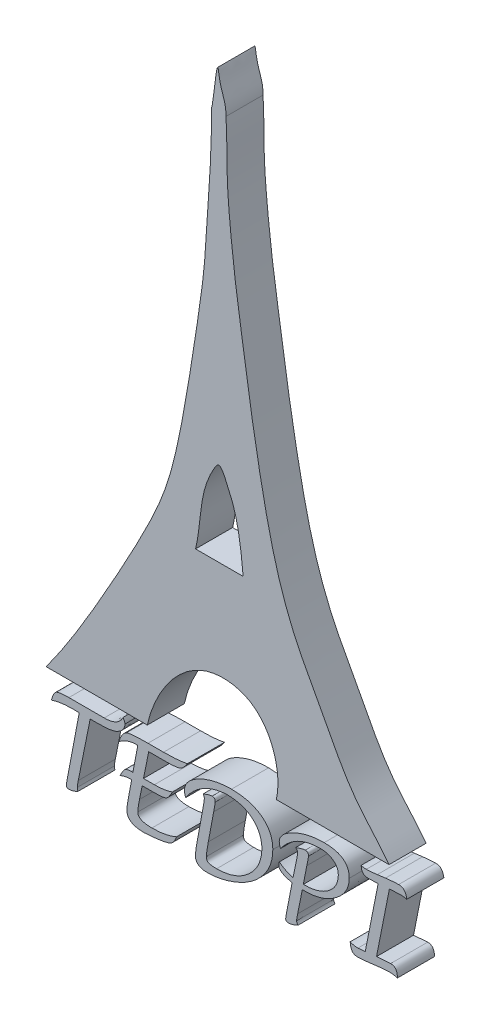
from build123d import *

# Parameters (mm, degrees)
BOSS_EXTRU_1_DEPTH   = 1
BOSS_EXTRU_1_2_DEPTH = 1
BOSS_EXTRU_1_3_DEPTH = 1
BOSS_EXTRU_1_4_DEPTH = 1
BOSS_EXTRU_1_5_DEPTH = 1
BOSS_EXTRU_1_6_DEPTH = 1


with BuildPart() as part:
    # Esquisse1 → Boss.-Extru.1 (new body)
    with BuildSketch(Plane(origin=(0, 0, 0), x_dir=(-1, 0, 0), z_dir=(0, 0, 1))):
        with BuildLine():
            Line((-9.25345197, 0), (-6.20988652, 0))
            add(Edge.make_bspline(
                [(-6.20988652, 0), (-6.364512035, -0.651193771), (-5.997425149, -2.018662685), (-3.760414389, -2.295973969), (-2.90296125, -0.821660596), (-2.72887651, 0)],
                knots=[0, 0, 0, 0, 0.357823488, 0.533216719, 1, 1, 1, 1], degree=3))
            Line((-2.72887651, 0), (0, 0))
            add(Edge.make_bspline(
                [(0, 0), (-0.266637156, -0.362097135), (-0.868381124, -1.271566499), (-1.800687904, -2.884842796), (-2.954905366, -5.00920102), (-3.546551325, -6.576602109), (-4.314065172, -11.570266654), (-4.242657305, -11.561191629), (-4.486958112, -14.363464562), (-4.455455932, -15.284127317)],
                knots=[0.014514793, 0.014514793, 0.014514793, 0.014514793, 0.096269171, 0.212292844, 0.360311529, 0.504022779, 0.634638445, 0.81550327, 1, 1, 1, 1], degree=3))
            add(Edge.make_bspline(
                [(-4.455455932, -15.284127317), (-4.510992049, -15.309080126), (-4.605458899, -16.728793681), (-4.698580197, -15.805155758), (-4.863317492, -15.613655378), (-4.850983862, -15.284127317)],
                knots=[0, 0, 0, 0, 0.498353275, 0.61035996, 1, 1, 1, 1], degree=3))
            add(Edge.make_bspline(
                [(-4.850983862, -15.284127317), (-4.884504035, -14.84958361), (-4.85700058, -14.054601122), (-4.951872842, -12.885825517), (-5.087512154, -11.603031655), (-5.334491386, -10.026875946), (-5.566264248, -8.475674929), (-5.858699688, -6.913032444), (-6.152151954, -5.536906865), (-6.691967043, -3.981119096), (-7.505034729, -2.585718485), (-8.221811644, -1.122452635), (-8.96583379, -0.385392032), (-9.25345197, 0)],
                knots=[0, 0, 0, 0, 0.080461436, 0.146708699, 0.216493488, 0.318839044, 0.441458773, 0.506316429, 0.612614329, 0.701349238, 0.809008659, 0.910910714, 1, 1, 1, 1], degree=3))
        make_face()
        with BuildLine():
            Line((-4.031723568, -4.768138167), (-5.315723412, -4.768138167))
            add(Edge.make_bspline(
                [(-4.031723568, -4.768138167), (-4.214992716, -5.549390431), (-4.091014941, -6.187409758), (-4.69007149, -7.162379563), (-4.901422086, -6.644112763), (-5.187579416, -6.03885912), (-5.277113262, -5.202000568), (-5.315723412, -4.768138167)],
                knots=[0, 0, 0, 0, 0.458128075, 0.4962874, 0.582630737, 0.670031659, 1, 1, 1, 1], degree=3))
        make_face(mode=Mode.SUBTRACT)
    extrude(amount=BOSS_EXTRU_1_DEPTH)


with BuildPart() as body_2:
    # Esquisse1 → Boss.-Extru.1 2 (new body)
    with BuildSketch(Plane(origin=(0, 0, 0), x_dir=(-1, 0, 0), z_dir=(0, 0, 1))):
        with BuildLine():
            Line((-1.187674204, 0.629220552), (-0.866664159, 2.226737293))
            add(Edge.make_bspline(
                [(-0.866664159, 2.226737293), (-0.862712306, 2.246958519), (-0.855553182, 2.283591022), (-0.846565727, 2.332755846), (-0.840981382, 2.370589151), (-0.839902421, 2.392044992), (-0.839459918, 2.400844436)],
                knots=[0, 0, 0, 0, 1.401604579, 2.53912826, 3.400868996, 4, 4, 4, 4], degree=3))
            add(Edge.make_bspline(
                [(-0.839459918, 2.400844436), (-0.840356619, 2.41465392), (-0.842256881, 2.443918584), (-0.852751324, 2.471329297), (-0.858293623, 2.485805374)],
                knots=[0, 0, 0, 0, 0.943765024, 2, 2, 2, 2], degree=3))
            add(Edge.make_bspline(
                [(-0.858293623, 2.485805374), (-0.836306823, 2.496714637), (-0.794381441, 2.517516893), (-0.731198699, 2.540372881), (-0.671298379, 2.554742502), (-0.632219575, 2.556802736), (-0.613455454, 2.557791981)],
                knots=[0, 0, 0, 0, 1.142981375, 2.179486264, 3.125860123, 4, 4, 4, 4], degree=3))
            add(Edge.make_bspline(
                [(-0.613455454, 2.557791981), (-0.603292388, 2.557259577), (-0.585111365, 2.556307143), (-0.560892239, 2.545087835), (-0.546459554, 2.523808755), (-0.545389335, 2.507227575), (-0.544817061, 2.498361177)],
                knots=[0, 0, 0, 0, 1.173873094, 2.099977993, 2.984007706, 4, 4, 4, 4], degree=3))
            add(Edge.make_bspline(
                [(-0.544817061, 2.498361177), (-0.544926172, 2.49528999), (-0.54518959, 2.487875489), (-0.546572396, 2.475038258), (-0.548705449, 2.458580102), (-0.551671013, 2.438493019), (-0.555411163, 2.41477113), (-0.560081272, 2.387437344), (-0.565517198, 2.356465145), (-0.569497614, 2.334575462), (-0.571602775, 2.322998454)],
                knots=[0, 0, 0, 0, 0.415422436, 1.002918479, 1.744610869, 2.659629722, 3.748161709, 4.991713678, 6.408978644, 8, 8, 8, 8], degree=3))
            Line((-0.571602775, 2.322998454), (-0.893031347, 0.629220552))
            Line((-0.893031347, 0.629220552), (-0.702601659, 0.629220552))
            add(Edge.make_bspline(
                [(-0.702601659, 0.629220552), (-0.676090454, 0.629455065), (-0.623877749, 0.629916927), (-0.546959692, 0.633755598), (-0.472689466, 0.639985173), (-0.401197414, 0.648713133), (-0.332484732, 0.659960541), (-0.266711359, 0.673775208), (-0.203663022, 0.689950427), (-0.163059607, 0.703094285), (-0.143031347, 0.709577695)],
                knots=[0, 0, 0, 0, 1.120541811, 2.206860021, 3.254344379, 4.270281703, 5.250384162, 6.196420316, 7.11035651, 8, 8, 8, 8], degree=3))
            add(Edge.make_bspline(
                [(-0.143031347, 0.709577695), (-0.146944536, 0.693918161), (-0.154431216, 0.663958476), (-0.167260492, 0.621520719), (-0.181538517, 0.583843437), (-0.196379768, 0.550481381), (-0.21274697, 0.52195592), (-0.229798305, 0.49765046), (-0.248301792, 0.478227718), (-0.268418227, 0.462515629), (-0.292537659, 0.451094143), (-0.321131895, 0.441111608), (-0.35565512, 0.432955792), (-0.395964973, 0.426524772), (-0.442031244, 0.421054907), (-0.49398548, 0.417440015), (-0.551776992, 0.415474272), (-0.592248532, 0.415120312), (-0.613455454, 0.414934838)],
                knots=[0, 0, 0, 0, 1.222784938, 2.33942165, 3.356261518, 4.273833514, 5.102351301, 5.844454584, 6.517238517, 7.128151184, 7.766252528, 8.528406232, 9.420484272, 10.449120314, 11.619819931, 12.933844532, 14.393347063, 16, 16, 16, 16], degree=3))
            Line((-0.613455454, 0.414934838), (-1.566440945, 0.414934838))
            add(Edge.make_bspline(
                [(-1.566440945, 0.414934838), (-1.597179406, 0.41419989), (-1.656283439, 0.41278673), (-1.740852545, 0.400178027), (-1.817369002, 0.379556778), (-1.885719842, 0.350111924), (-1.946038499, 0.312120152), (-1.998153934, 0.265531199), (-2.042240657, 0.210369995), (-2.063917905, 0.168425974), (-2.07495099, 0.147077695)],
                knots=[0, 0, 0, 0, 1.208628186, 2.323954972, 3.354505194, 4.317990757, 5.240644316, 6.146246987, 7.056493975, 8, 8, 8, 8], degree=3))
            add(Edge.make_bspline(
                [(-2.07495099, 0.147077695), (-2.082424402, 0.159796285), (-2.096353344, 0.183501188), (-2.112509119, 0.218062199), (-2.12259021, 0.24906895), (-2.124362163, 0.268673696), (-2.125174204, 0.277658052)],
                knots=[0, 0, 0, 0, 1.251728235, 2.332970558, 3.23604283, 4, 4, 4, 4], degree=3))
            add(Edge.make_bspline(
                [(-2.125174204, 0.277658052), (-2.124437769, 0.292236121), (-2.12297923, 0.321108559), (-2.111661204, 0.363072858), (-2.093250475, 0.402823865), (-2.067392923, 0.44020475), (-2.034099355, 0.475280645), (-1.993600775, 0.507848961), (-1.945796663, 0.538029153), (-1.910776816, 0.555589382), (-1.892473311, 0.564767427)],
                knots=[0, 0, 0, 0, 0.892787757, 1.768201222, 2.644491583, 3.567293627, 4.541419233, 5.599309121, 6.74525278, 8, 8, 8, 8], degree=3))
            add(Edge.make_bspline(
                [(-1.892473311, 0.564767427), (-1.879595137, 0.570069899), (-1.85170978, 0.581551441), (-1.804494153, 0.593729252), (-1.749799636, 0.605192263), (-1.68717143, 0.614179003), (-1.616608717, 0.620552732), (-1.538451839, 0.625450988), (-1.452355324, 0.629040837), (-1.392337938, 0.629158832), (-1.360944293, 0.629220552)],
                knots=[0, 0, 0, 0, 0.620069838, 1.342649124, 2.168215605, 3.110866794, 4.16018741, 5.325311498, 6.600935014, 8, 8, 8, 8], degree=3))
            Line((-1.360944293, 0.629220552), (-1.187674204, 0.629220552))
        make_face()
    extrude(amount=BOSS_EXTRU_1_2_DEPTH)


with BuildPart() as body_3:
    # Esquisse1 → Boss.-Extru.1 3 (new body)
    with BuildSketch(Plane(origin=(0, 0, 0), x_dir=(-1, 0, 0), z_dir=(0, 0, 1))):
        with BuildLine():
            Line((-2.592250097, 1.486363409), (-2.519007909, 1.843366758))
            add(Edge.make_bspline(
                [(-2.519007909, 1.843366758), (-2.515329958, 1.861213449), (-2.508271993, 1.895461128), (-2.498910435, 1.944970311), (-2.49168963, 1.99055312), (-2.484702963, 2.031899241), (-2.479587962, 2.069297812), (-2.476342528, 2.102678099), (-2.474045732, 2.132119988), (-2.473597148, 2.150422535), (-2.47338849, 2.158935954)],
                knots=[0, 0, 0, 0, 1.369794428, 2.628626304, 3.787229638, 4.838949575, 5.78076992, 6.623942657, 7.359927718, 8, 8, 8, 8], degree=3))
            add(Edge.make_bspline(
                [(-2.47338849, 2.158935954), (-2.473772418, 2.166345752), (-2.47452467, 2.180864145), (-2.47861476, 2.202128611), (-2.486238273, 2.221890775), (-2.496941721, 2.240171863), (-2.510403697, 2.25702009), (-2.526935809, 2.272230773), (-2.546634413, 2.285526013), (-2.568720937, 2.298202402), (-2.594138275, 2.309110551), (-2.622562709, 2.317971067), (-2.653783026, 2.32618162), (-2.687979427, 2.332117481), (-2.725106558, 2.337202214), (-2.765174391, 2.340979129), (-2.808329671, 2.342942281), (-2.838063054, 2.343314259), (-2.853410811, 2.343506267)],
                knots=[0, 0, 0, 0, 0.758995242, 1.487137945, 2.205837577, 2.916117723, 3.647613365, 4.405533162, 5.205725985, 6.075403505, 7.009192337, 8.029791651, 9.120791459, 10.311186156, 11.579460708, 12.956357041, 14.428934524, 16, 16, 16, 16], degree=3))
            add(Edge.make_bspline(
                [(-2.853410811, 2.343506267), (-2.88439168, 2.343089903), (-2.945432465, 2.342269553), (-3.03563808, 2.336206607), (-3.123109752, 2.326815973), (-3.20778485, 2.313018518), (-3.289490679, 2.29499347), (-3.368375784, 2.273086437), (-3.444771116, 2.247989342), (-3.493743992, 2.227347959), (-3.518031347, 2.217111177)],
                knots=[0, 0, 0, 0, 1.091185852, 2.149934515, 3.183161847, 4.188949639, 5.170201585, 6.128722393, 7.071968257, 8, 8, 8, 8], degree=3))
            add(Edge.make_bspline(
                [(-3.518031347, 2.217111177), (-3.512460256, 2.233406114), (-3.501716672, 2.264830121), (-3.4814973, 2.308536061), (-3.458912334, 2.347570063), (-3.433335415, 2.381428553), (-3.405463154, 2.411110644), (-3.374386937, 2.435165594), (-3.340966183, 2.455211508), (-3.316757051, 2.463872022), (-3.304582686, 2.468227249)],
                knots=[0, 0, 0, 0, 1.204503812, 2.322828134, 3.364358614, 4.354368776, 5.286606837, 6.204573659, 7.0971103, 8, 8, 8, 8], degree=3))
            add(Edge.make_bspline(
                [(-3.304582686, 2.468227249), (-3.296371782, 2.470674058), (-3.278657763, 2.47595275), (-3.249655692, 2.482768968), (-3.216836055, 2.490531791), (-3.179605, 2.497376118), (-3.138489504, 2.504987693), (-3.093004107, 2.512532913), (-3.043458933, 2.51995873), (-2.990864959, 2.527381983), (-2.937832777, 2.534219516), (-2.886812771, 2.540735559), (-2.838897613, 2.545480705), (-2.794444212, 2.550304209), (-2.75300431, 2.553809489), (-2.714879047, 2.555541828), (-2.679883208, 2.55765287), (-2.657682716, 2.557747009), (-2.647077106, 2.557791981)],
                knots=[0, 0, 0, 0, 0.618399627, 1.334121407, 2.150169791, 3.052857289, 4.066292664, 5.169029574, 6.38118356, 7.68303305, 9.003488793, 10.241476707, 11.395982793, 12.479323902, 13.469624098, 14.397578872, 15.23449201, 16, 16, 16, 16], degree=3))
            add(Edge.make_bspline(
                [(-2.647077106, 2.557791981), (-2.628099119, 2.557531292), (-2.591507468, 2.557028654), (-2.538415499, 2.553740455), (-2.488929903, 2.547982477), (-2.443099404, 2.539653218), (-2.400780578, 2.529307846), (-2.362335556, 2.516308604), (-2.327251404, 2.501444047), (-2.296134387, 2.483620374), (-2.268181796, 2.464086435), (-2.244073451, 2.441717334), (-2.223861367, 2.416872681), (-2.207337611, 2.389660043), (-2.194303431, 2.360285635), (-2.185077814, 2.328483759), (-2.17953817, 2.294315916), (-2.179015024, 2.270704114), (-2.178745632, 2.258545329)],
                knots=[0, 0, 0, 0, 1.448753249, 2.793356128, 4.058870923, 5.249577863, 6.347355419, 7.381284041, 8.344800683, 9.250990466, 10.113903926, 10.942827542, 11.752858394, 12.551040689, 13.366375038, 14.198780537, 15.072470629, 16, 16, 16, 16], degree=3))
            add(Edge.make_bspline(
                [(-2.178745632, 2.258545329), (-2.179000174, 2.251150694), (-2.179567257, 2.234676474), (-2.181093423, 2.207702417), (-2.184727026, 2.176197574), (-2.189335811, 2.140063412), (-2.195198835, 2.099322417), (-2.202284295, 2.053809388), (-2.211251193, 2.003941092), (-2.217400281, 1.969066031), (-2.220598311, 1.950928142)],
                knots=[0, 0, 0, 0, 0.571485548, 1.27319047, 2.085905616, 3.020111636, 4.086789848, 5.264826618, 6.577485764, 8, 8, 8, 8], degree=3))
            Line((-2.220598311, 1.950928142), (-2.307651882, 1.486363409))
            Line((-2.307651882, 1.486363409), (-2.285051436, 1.486363409))
            add(Edge.make_bspline(
                [(-2.285051436, 1.486363409), (-2.259886415, 1.487025742), (-2.209699335, 1.488346643), (-2.135373077, 1.500946162), (-2.061884166, 1.519138672), (-2.014915373, 1.537975549), (-1.991245632, 1.54746832)],
                knots=[0, 0, 0, 0, 0.998842452, 1.992010494, 2.988081458, 4, 4, 4, 4], degree=3))
            add(Edge.make_bspline(
                [(-1.991245632, 1.54746832), (-1.997711514, 1.534724405), (-2.010168156, 1.510173015), (-2.029481234, 1.475748276), (-2.047316471, 1.44458501), (-2.064610773, 1.417302219), (-2.080714946, 1.39339577), (-2.096206265, 1.373367318), (-2.110483784, 1.356618933), (-2.128952445, 1.339012815), (-2.15603566, 1.322045691), (-2.194580553, 1.3085525), (-2.240482475, 1.30030276), (-2.273572703, 1.299366057), (-2.291329338, 1.298863409)],
                knots=[0, 0, 0, 0, 1.223216676, 2.356549606, 3.378710975, 4.296541232, 5.121390966, 5.845203523, 6.463134311, 7.003879395, 8.024294971, 9.169148098, 10.480929029, 12, 12, 12, 12], degree=3))
            Line((-2.291329338, 1.298863409), (-2.340296972, 1.298863409))
            Line((-2.340296972, 1.298863409), (-2.47338849, 0.602434838))
            Line((-2.47338849, 0.602434838), (-2.433628445, 0.602434838))
            add(Edge.make_bspline(
                [(-2.433628445, 0.602434838), (-2.412674402, 0.602870067), (-2.371031125, 0.603735024), (-2.309317872, 0.612138882), (-2.24861954, 0.624946737), (-2.189406753, 0.643614625), (-2.130918936, 0.666544302), (-2.074138803, 0.695892086), (-2.017868038, 0.729417097), (-1.98238454, 0.755720989), (-1.964459918, 0.769008499)],
                knots=[0, 0, 0, 0, 0.99106993, 1.969615174, 2.942061695, 3.923497774, 4.904245273, 5.911044165, 6.944756136, 8, 8, 8, 8], degree=3))
            add(Edge.make_bspline(
                [(-1.964459918, 0.769008499), (-1.970382279, 0.750241475), (-1.98180978, 0.714029535), (-2.001792229, 0.66292227), (-2.023715678, 0.617187864), (-2.046379887, 0.576157974), (-2.071616531, 0.540982885), (-2.098129275, 0.510678482), (-2.126560586, 0.485677197), (-2.14731345, 0.472714428), (-2.157400766, 0.466413633)],
                knots=[0, 0, 0, 0, 1.285471345, 2.480383137, 3.581101955, 4.597417589, 5.538267353, 6.403405716, 7.223945578, 8, 8, 8, 8], degree=3))
            add(Edge.make_bspline(
                [(-2.157400766, 0.466413633), (-2.167346237, 0.462073885), (-2.190747674, 0.451862571), (-2.234127458, 0.442634861), (-2.289282048, 0.433919838), (-2.35695468, 0.427271392), (-2.436889193, 0.421237327), (-2.52945264, 0.418007745), (-2.634365355, 0.415290774), (-2.708458504, 0.415057716), (-2.747523534, 0.414934838)],
                knots=[0, 0, 0, 0, 0.436695045, 1.027532212, 1.779503482, 2.690324931, 3.767773729, 5.012150341, 6.424679776, 8, 8, 8, 8], degree=3))
            Line((-2.747523534, 0.414934838), (-3.1673059, 0.414934838))
            add(Edge.make_bspline(
                [(-3.1673059, 0.414934838), (-3.199673665, 0.414781676), (-3.26288473, 0.414482564), (-3.355258647, 0.411940365), (-3.442893373, 0.407820069), (-3.525925381, 0.401975673), (-3.604370006, 0.394559643), (-3.678066606, 0.385382194), (-3.747056577, 0.374647328), (-3.791218899, 0.365706915), (-3.812674204, 0.361363409)],
                knots=[0, 0, 0, 0, 1.19746698, 2.338535426, 3.418481981, 4.442971538, 5.417734017, 6.333192775, 7.190217911, 8, 8, 8, 8], degree=3))
            add(Edge.make_bspline(
                [(-3.812674204, 0.361363409), (-3.803424722, 0.37482519), (-3.785768641, 0.400522011), (-3.758774565, 0.436484092), (-3.732543243, 0.468208253), (-3.707094237, 0.496012146), (-3.682218239, 0.519476017), (-3.658647562, 0.539638808), (-3.634979819, 0.55448496), (-3.611617837, 0.566986603), (-3.584735614, 0.575268791), (-3.553019615, 0.582734422), (-3.51468192, 0.588857161), (-3.470101301, 0.59357692), (-3.419178947, 0.597887123), (-3.361947023, 0.60063727), (-3.298175857, 0.602325865), (-3.253523663, 0.602397327), (-3.230084918, 0.602434838)],
                knots=[0, 0, 0, 0, 1.161083808, 2.216360737, 3.195433503, 4.086785189, 4.893564246, 5.626288916, 6.286562503, 6.876495873, 7.503765189, 8.278385654, 9.193102627, 10.260981431, 11.46515065, 12.825688978, 14.333746695, 16, 16, 16, 16], degree=3))
            Line((-3.230084918, 0.602434838), (-2.768031347, 0.602434838))
            Line((-2.768031347, 0.602434838), (-2.626569293, 1.298863409))
            Line((-2.626569293, 1.298863409), (-2.91995657, 1.298863409))
            add(Edge.make_bspline(
                [(-2.91995657, 1.298863409), (-2.944934424, 1.298645704), (-2.993664147, 1.298220979), (-3.064845467, 1.294245697), (-3.132163953, 1.288607429), (-3.195633057, 1.280416286), (-3.255075895, 1.268971822), (-3.310669888, 1.255639102), (-3.362654418, 1.240566124), (-3.3950799, 1.227424461), (-3.41088849, 1.221017427)],
                knots=[0, 0, 0, 0, 1.198323991, 2.33783079, 3.41956828, 4.43913016, 5.406651693, 6.32230685, 7.18206418, 8, 8, 8, 8], degree=3))
            add(Edge.make_bspline(
                [(-3.41088849, 1.221017427), (-3.403014621, 1.235985682), (-3.387955078, 1.264613931), (-3.365183118, 1.304930767), (-3.342301194, 1.340147253), (-3.320888586, 1.371147059), (-3.29987037, 1.397394067), (-3.279570328, 1.41887382), (-3.259595465, 1.435553931), (-3.239273758, 1.448727129), (-3.215684235, 1.458157969), (-3.187068388, 1.465359239), (-3.152421331, 1.472011677), (-3.111322011, 1.477248277), (-3.063990108, 1.4813786), (-3.01024029, 1.484050558), (-2.950249961, 1.486402412), (-2.908101144, 1.486376803), (-2.8860559, 1.486363409)],
                knots=[0, 0, 0, 0, 1.258057071, 2.406156948, 3.442401729, 4.380931111, 5.207450049, 5.941360488, 6.575121673, 7.139404566, 7.734884438, 8.454796007, 9.331942917, 10.357796007, 11.534978032, 12.865216948, 14.360403409, 16, 16, 16, 16], degree=3))
            Line((-2.8860559, 1.486363409), (-2.592250097, 1.486363409))
        make_face()
    extrude(amount=BOSS_EXTRU_1_3_DEPTH)


with BuildPart() as body_4:
    # Esquisse1 → Boss.-Extru.1 4 (new body)
    with BuildSketch(Plane(origin=(0, 0, 0), x_dir=(-1, 0, 0), z_dir=(0, 0, 1))):
        with BuildLine():
            add(Edge.make_bspline(
                [(-3.767473311, 1.175398008), (-3.761998187, 1.163097335), (-3.75120156, 1.138841119), (-3.740550838, 1.100656076), (-3.733405817, 1.062108412), (-3.732679659, 1.036060828), (-3.732317061, 1.023054258)],
                knots=[0, 0, 0, 0, 1.023788768, 2.018852301, 3.010735984, 4, 4, 4, 4], degree=3))
            add(Edge.make_bspline(
                [(-3.732317061, 1.023054258), (-3.733598753, 1.001867302), (-3.736174106, 0.959295567), (-3.755100197, 0.896545817), (-3.78647937, 0.836222365), (-3.829463804, 0.777341916), (-3.885289943, 0.720932841), (-3.95255368, 0.665618855), (-4.032366872, 0.612708462), (-4.122401583, 0.562131661), (-4.22011133, 0.515597208), (-4.322241716, 0.473857641), (-4.427933381, 0.439321392), (-4.536645503, 0.410723051), (-4.648616898, 0.388613057), (-4.763883575, 0.372650584), (-4.882418336, 0.363474548), (-4.962491422, 0.362072218), (-5.002964382, 0.361363409)],
                knots=[0, 0, 0, 0, 0.657487116, 1.32111326, 2.016782189, 2.761258502, 3.576326296, 4.475064884, 5.461690477, 6.546238862, 7.679975817, 8.820909811, 9.970499166, 11.13075221, 12.31020684, 13.513074527, 14.742982915, 16, 16, 16, 16], degree=3))
            add(Edge.make_bspline(
                [(-5.002964382, 0.361363409), (-5.04497644, 0.362131759), (-5.126902269, 0.363630084), (-5.246364216, 0.373948547), (-5.358948768, 0.391929218), (-5.464672302, 0.416828984), (-5.563565761, 0.449076895), (-5.655660562, 0.488453949), (-5.741037017, 0.534895477), (-5.818974297, 0.58853499), (-5.889059242, 0.648099987), (-5.949866486, 0.713898567), (-6.001240004, 0.785039992), (-6.043521853, 0.861434584), (-6.076292755, 0.943278562), (-6.09969363, 1.030350181), (-6.113749517, 1.122764036), (-6.115400509, 1.186090293), (-6.116245632, 1.218506267)],
                knots=[0, 0, 0, 0, 1.272919755, 2.48226367, 3.629610339, 4.724611769, 5.76994057, 6.777343431, 7.755343991, 8.709765894, 9.6391277, 10.536543883, 11.417613819, 12.291720436, 13.175574491, 14.08203435, 15.018215706, 16, 16, 16, 16], degree=3))
            add(Edge.make_bspline(
                [(-6.116245632, 1.218506267), (-6.115955489, 1.240420254), (-6.115377985, 1.284037986), (-6.109756568, 1.349027132), (-6.100538381, 1.413000307), (-6.087944559, 1.475866228), (-6.072113815, 1.537883632), (-6.051914189, 1.598711498), (-6.028364744, 1.658748305), (-6.001696386, 1.717853998), (-5.970957909, 1.77578706), (-5.936492848, 1.832632047), (-5.898966486, 1.888879422), (-5.857243693, 1.943637642), (-5.812432485, 1.997809668), (-5.76389184, 2.05094984), (-5.711473023, 2.102857451), (-5.67455396, 2.13619944), (-5.655866168, 2.153076579)],
                knots=[0, 0, 0, 0, 0.977452575, 1.945527505, 2.907561629, 3.859618878, 4.804590704, 5.761112965, 6.716926279, 7.680650018, 8.652299514, 9.640687997, 10.645324625, 11.667278248, 12.7103904, 13.780900877, 14.876730375, 16, 16, 16, 16], degree=3))
            add(Edge.make_bspline(
                [(-5.655866168, 2.153076579), (-5.635150834, 2.170778678), (-5.593428804, 2.206431856), (-5.52633658, 2.255583663), (-5.455933463, 2.303088426), (-5.381657982, 2.34811273), (-5.303459076, 2.390602866), (-5.221391602, 2.430021403), (-5.1358646, 2.468016485), (-5.04709326, 2.502639496), (-4.956955395, 2.534321425), (-4.867027482, 2.561928633), (-4.778108121, 2.585447842), (-4.690196672, 2.604944188), (-4.60309481, 2.619289029), (-4.517152738, 2.630522603), (-4.432191233, 2.636870621), (-4.375881375, 2.637725421), (-4.347969963, 2.638149124)],
                knots=[0, 0, 0, 0, 0.919795451, 1.852527846, 2.80629241, 3.787070745, 4.784106647, 5.810144182, 6.860495104, 7.943466646, 9.02657137, 10.086020325, 11.118944783, 12.131648744, 13.125251193, 14.0986826, 15.057563708, 16, 16, 16, 16], degree=3))
            add(Edge.make_bspline(
                [(-4.347969963, 2.638149124), (-4.334988136, 2.638042924), (-4.309825589, 2.637837077), (-4.273377944, 2.634707017), (-4.239351648, 2.630362844), (-4.208047592, 2.62361803), (-4.179137118, 2.615311376), (-4.152855322, 2.604811056), (-4.128696532, 2.592790985), (-4.107330574, 2.578424082), (-4.088157644, 2.56248832), (-4.071850667, 2.544338648), (-4.057770116, 2.524472207), (-4.046548604, 2.502579581), (-4.037626763, 2.47886242), (-4.031490246, 2.453274798), (-4.027607804, 2.425795712), (-4.027180545, 2.406857136), (-4.026959918, 2.397077695)],
                knots=[0, 0, 0, 0, 1.360560118, 2.637160203, 3.832764921, 4.954421671, 5.991136236, 6.982492785, 7.917889927, 8.814399605, 9.675862417, 10.524943832, 11.36490597, 12.221887154, 13.096657102, 14.015440047, 14.975219387, 16, 16, 16, 16], degree=3))
            add(Edge.make_bspline(
                [(-4.026959918, 2.397077695), (-4.027151874, 2.388841835), (-4.027581999, 2.370387349), (-4.030475032, 2.339851613), (-4.034091098, 2.303406162), (-4.0396731, 2.261138683), (-4.046822404, 2.213008952), (-4.055586249, 2.159147989), (-4.066266871, 2.099498853), (-4.073698634, 2.057792493), (-4.077601659, 2.035889079)],
                knots=[0, 0, 0, 0, 0.54147946, 1.213318843, 2.015571776, 2.949621452, 4.015904618, 5.214713507, 6.537218728, 8, 8, 8, 8], degree=3))
            Line((-4.077601659, 2.035889079), (-4.245849427, 1.115130151))
            add(Edge.make_bspline(
                [(-4.245849427, 1.115130151), (-4.249129243, 1.096726241), (-4.255157829, 1.062898257), (-4.262460104, 1.016202128), (-4.267099503, 0.977807756), (-4.26774761, 0.954843373), (-4.268031347, 0.944789749)],
                knots=[0, 0, 0, 0, 1.304384607, 2.397572197, 3.298469898, 4, 4, 4, 4], degree=3))
            add(Edge.make_bspline(
                [(-4.268031347, 0.944789749), (-4.26761969, 0.936657701), (-4.266806711, 0.920597728), (-4.260559088, 0.897179674), (-4.251075145, 0.874706925), (-4.241773985, 0.861221882), (-4.237060365, 0.854387963)],
                knots=[0, 0, 0, 0, 1.003243257, 1.981303999, 2.976969893, 4, 4, 4, 4], degree=3))
            add(Edge.make_bspline(
                [(-4.237060365, 0.854387963), (-4.251115646, 0.848716126), (-4.277982544, 0.837874319), (-4.31689688, 0.823824657), (-4.352267688, 0.81147889), (-4.384306662, 0.801328999), (-4.413259226, 0.793797321), (-4.43879838, 0.788291496), (-4.461011106, 0.78464646), (-4.474773103, 0.78396728), (-4.481061481, 0.783656936)],
                knots=[0, 0, 0, 0, 1.425737763, 2.725320837, 3.891623633, 4.950155405, 5.886047386, 6.704615923, 7.408089939, 8, 8, 8, 8], degree=3))
            add(Edge.make_bspline(
                [(-4.481061481, 0.783656936), (-4.487514239, 0.783958754), (-4.49962989, 0.784525446), (-4.516646834, 0.789273895), (-4.531308363, 0.797145479), (-4.542751982, 0.809143384), (-4.552346543, 0.823577769), (-4.558272904, 0.841610631), (-4.562111014, 0.862452313), (-4.562478163, 0.877385378), (-4.562674204, 0.885358945)],
                knots=[0, 0, 0, 0, 1.038129704, 1.9491847, 2.824875543, 3.683368585, 4.593868567, 5.596578712, 6.716684152, 8, 8, 8, 8], degree=3))
            add(Edge.make_bspline(
                [(-4.562674204, 0.885358945), (-4.562399257, 0.888428342), (-4.561661117, 0.896668661), (-4.560115793, 0.912073729), (-4.556389496, 0.933630607), (-4.551941513, 0.961414907), (-4.546107986, 0.995489022), (-4.538277998, 1.035561903), (-4.530230356, 1.082129653), (-4.523816071, 1.11514216), (-4.520402998, 1.132708276)],
                knots=[0, 0, 0, 0, 0.294663976, 0.791075689, 1.479673662, 2.385338686, 3.481801968, 4.784642679, 6.289092682, 8, 8, 8, 8], degree=3))
            Line((-4.520402998, 1.132708276), (-4.376011257, 1.906145776))
            add(Edge.make_bspline(
                [(-4.376011257, 1.906145776), (-4.371854048, 1.929727543), (-4.363957735, 1.974519374), (-4.352317456, 2.038030303), (-4.343352084, 2.094898925), (-4.335120685, 2.144759787), (-4.329334469, 2.187910096), (-4.325067988, 2.22403682), (-4.322280058, 2.253340864), (-4.321808003, 2.270678502), (-4.321602775, 2.278216088)],
                knots=[0, 0, 0, 0, 1.527204935, 2.90081332, 4.117836539, 5.198850908, 6.123732131, 6.894082625, 7.519199398, 8, 8, 8, 8], degree=3))
            add(Edge.make_bspline(
                [(-4.321602775, 2.278216088), (-4.322236913, 2.291275228), (-4.323416209, 2.315561133), (-4.334212353, 2.348692878), (-4.353169353, 2.37471548), (-4.375456899, 2.38958655), (-4.396795546, 2.398011157), (-4.416254278, 2.403915598), (-4.438849041, 2.408652842), (-4.464488538, 2.413404428), (-4.493415093, 2.417073927), (-4.525542683, 2.419804311), (-4.560827604, 2.422494242), (-4.585409282, 2.423393633), (-4.598248981, 2.423863409)],
                knots=[0, 0, 0, 0, 1.317892604, 2.450866955, 3.469263134, 4.513890057, 5.108478704, 5.786692803, 6.566942506, 7.44122459, 8.422713262, 9.513276501, 10.701114631, 12, 12, 12, 12], degree=3))
            add(Edge.make_bspline(
                [(-4.598248981, 2.423863409), (-4.640847128, 2.422460684), (-4.72436585, 2.419710473), (-4.846878082, 2.403900989), (-4.964011032, 2.379005808), (-5.075759983, 2.344101018), (-5.182305526, 2.300003286), (-5.283509475, 2.246419452), (-5.379021348, 2.182607673), (-5.468368129, 2.11041803), (-5.549569198, 2.030881981), (-5.62127206, 1.946190386), (-5.682007856, 1.856377147), (-5.732217821, 1.761765027), (-5.771229098, 1.66215372), (-5.799231205, 1.557861324), (-5.817413677, 1.448899899), (-5.82019065, 1.374409897), (-5.821602775, 1.33653082)],
                knots=[0, 0, 0, 0, 1.122741769, 2.201268458, 3.2505137, 4.275014275, 5.282141901, 6.28544362, 7.287835468, 8.304760682, 9.308338569, 10.279036961, 11.224343396, 12.160171412, 13.096230519, 14.037186872, 15.001885502, 16, 16, 16, 16], degree=3))
            add(Edge.make_bspline(
                [(-5.821602775, 1.33653082), (-5.820528817, 1.307462395), (-5.818421798, 1.250432468), (-5.805132066, 1.167425112), (-5.784627712, 1.088874431), (-5.756562171, 1.01484544), (-5.720766178, 0.945347843), (-5.677397795, 0.880342187), (-5.625914636, 0.82030086), (-5.56727519, 0.765196879), (-5.502380661, 0.715389188), (-5.431776908, 0.671670284), (-5.355611858, 0.634687464), (-5.273980406, 0.604864499), (-5.187597987, 0.580353187), (-5.095733656, 0.562917731), (-4.998614392, 0.552021527), (-4.931982835, 0.549931857), (-4.897914159, 0.548863409)],
                knots=[0, 0, 0, 0, 1.023940138, 2.008888733, 2.954195864, 3.879724075, 4.791911944, 5.702443397, 6.626247604, 7.57189961, 8.532276638, 9.503333326, 10.492441971, 11.509423372, 12.561197342, 13.652286593, 14.799615485, 16, 16, 16, 16], degree=3))
            add(Edge.make_bspline(
                [(-4.897914159, 0.548863409), (-4.869709833, 0.549749976), (-4.813593465, 0.551513922), (-4.73032989, 0.560679279), (-4.648391156, 0.573910095), (-4.567867866, 0.59238362), (-4.488825526, 0.615920723), (-4.411132572, 0.643851605), (-4.335293938, 0.677267494), (-4.260681873, 0.714642332), (-4.188703718, 0.757470219), (-4.118867597, 0.803738229), (-4.052565217, 0.855084354), (-3.989531097, 0.910871183), (-3.928881948, 0.97040811), (-3.871664389, 1.034501908), (-3.817406942, 1.10283236), (-3.784218596, 1.151063057), (-3.767473311, 1.175398008)],
                knots=[0, 0, 0, 0, 1.005892364, 2.001360564, 2.984407986, 3.964316144, 4.944943816, 5.923765391, 6.906221029, 7.898477029, 8.897555898, 9.890970981, 10.884024774, 11.885046259, 12.891123129, 13.912797506, 14.946895376, 16, 16, 16, 16], degree=3))
        make_face()
    extrude(amount=BOSS_EXTRU_1_4_DEPTH)


with BuildPart() as body_5:
    # Esquisse1 → Boss.-Extru.1 5 (new body)
    with BuildSketch(Plane(origin=(0, 0, 0), x_dir=(-1, 0, 0), z_dir=(0, 0, 1))):
        with BuildLine():
            Line((-6.913539159, 1.752964972), (-6.786725543, 2.382847784))
            add(Edge.make_bspline(
                [(-6.786725543, 2.382847784), (-6.784682791, 2.393738929), (-6.780804134, 2.414418391), (-6.774483594, 2.44385586), (-6.770340783, 2.470497368), (-6.765758381, 2.493960983), (-6.762947058, 2.514519627), (-6.760842535, 2.531957707), (-6.759412882, 2.546468565), (-6.759199135, 2.555138888), (-6.759102775, 2.559047561)],
                knots=[0, 0, 0, 0, 1.489587188, 2.828339933, 4.046172168, 5.112989152, 6.041247165, 6.834462012, 7.474563192, 8, 8, 8, 8], degree=3))
            add(Edge.make_bspline(
                [(-6.759102775, 2.559047561), (-6.759511604, 2.565932745), (-6.760364092, 2.58028973), (-6.767617462, 2.601828302), (-6.779155768, 2.623919943), (-6.789575333, 2.63787178), (-6.795096079, 2.645264079)],
                knots=[0, 0, 0, 0, 0.866669462, 1.807179026, 2.83814658, 4, 4, 4, 4], degree=3))
            add(Edge.make_bspline(
                [(-6.795096079, 2.645264079), (-6.772027555, 2.656561823), (-6.727894719, 2.678175754), (-6.66087598, 2.700462293), (-6.597804482, 2.715580674), (-6.556612301, 2.717558237), (-6.536865052, 2.718506267)],
                knots=[0, 0, 0, 0, 1.137214901, 2.175627703, 3.125408418, 4, 4, 4, 4], degree=3))
            add(Edge.make_bspline(
                [(-6.536865052, 2.718506267), (-6.526142631, 2.718009729), (-6.506961503, 2.717121483), (-6.481657274, 2.705648886), (-6.466427349, 2.684099569), (-6.465147012, 2.667270005), (-6.464459918, 2.658238409)],
                knots=[0, 0, 0, 0, 1.195443839, 2.138506027, 3.00102822, 4, 4, 4, 4], degree=3))
            add(Edge.make_bspline(
                [(-6.464459918, 2.658238409), (-6.464568345, 2.655027769), (-6.464828147, 2.647334797), (-6.46620436, 2.634077654), (-6.468368031, 2.617205625), (-6.471183278, 2.596652247), (-6.475667121, 2.572611288), (-6.479960307, 2.54474665), (-6.48616473, 2.513467904), (-6.490037876, 2.491254785), (-6.492082686, 2.479527472)],
                knots=[0, 0, 0, 0, 0.425972145, 1.020665967, 1.766547661, 2.682401791, 3.771412643, 5.009458733, 6.421157598, 8, 8, 8, 8], degree=3))
            Line((-6.492082686, 2.479527472), (-6.637730007, 1.730364526))
            add(Edge.make_bspline(
                [(-6.637730007, 1.730364526), (-6.609458411, 1.723739166), (-6.556265046, 1.711273468), (-6.482682207, 1.688473093), (-6.420161578, 1.663158349), (-6.368735872, 1.635529264), (-6.328030067, 1.605424816), (-6.299181067, 1.572234086), (-6.279918427, 1.536352551), (-6.277936569, 1.510715826), (-6.276959918, 1.498082159)],
                knots=[0, 0, 0, 0, 1.520961501, 2.861708237, 4.031709016, 5.04901747, 5.914440047, 6.665982175, 7.342601854, 8, 8, 8, 8], degree=3))
            add(Edge.make_bspline(
                [(-6.276959918, 1.498082159), (-6.277863008, 1.485884497), (-6.279913082, 1.458194979), (-6.287412531, 1.431438995), (-6.291608356, 1.416469436)],
                knots=[0, 0, 0, 0, 0.881031003, 2, 2, 2, 2], degree=3))
            add(Edge.make_bspline(
                [(-6.291608356, 1.416469436), (-6.318092616, 1.436391324), (-6.371660096, 1.476685645), (-6.461479116, 1.525533349), (-6.558543801, 1.567410242), (-6.627555233, 1.586892808), (-6.662841615, 1.596854481)],
                knots=[0, 0, 0, 0, 0.955387454, 1.932381636, 2.942801651, 4, 4, 4, 4], degree=3))
            Line((-6.662841615, 1.596854481), (-6.761613936, 1.116385731))
            add(Edge.make_bspline(
                [(-6.761613936, 1.116385731), (-6.765205024, 1.098128184), (-6.77179747, 1.064611358), (-6.779421794, 1.01829413), (-6.784452116, 0.980469446), (-6.78545419, 0.957913667), (-6.78588849, 0.948137963)],
                knots=[0, 0, 0, 0, 1.311981543, 2.408508475, 3.310245538, 4, 4, 4, 4], degree=3))
            add(Edge.make_bspline(
                [(-6.78588849, 0.948137963), (-6.785183658, 0.940096879), (-6.7837648, 0.923909814), (-6.773778878, 0.900410039), (-6.757469304, 0.87835865), (-6.742930156, 0.865961647), (-6.735246748, 0.859410284)],
                knots=[0, 0, 0, 0, 0.911988458, 1.835873813, 2.856338541, 4, 4, 4, 4], degree=3))
            add(Edge.make_bspline(
                [(-6.735246748, 0.859410284), (-6.750161487, 0.853935501), (-6.77866098, 0.843474135), (-6.819703932, 0.829014408), (-6.857327563, 0.817399041), (-6.891533882, 0.807696165), (-6.922017548, 0.79967789), (-6.949088099, 0.793976664), (-6.972627945, 0.791022749), (-6.987194348, 0.790277654), (-6.993896302, 0.789934838)],
                knots=[0, 0, 0, 0, 1.418453826, 2.710420617, 3.884370319, 4.933111526, 5.884680036, 6.698081094, 7.400991436, 8, 8, 8, 8], degree=3))
            add(Edge.make_bspline(
                [(-6.993896302, 0.789934838), (-7.000765244, 0.790240709), (-7.013700253, 0.7908167), (-7.031633802, 0.795460606), (-7.047177892, 0.803043299), (-7.059195827, 0.814800736), (-7.069369456, 0.828938492), (-7.07570665, 0.846589462), (-7.080094025, 0.867004949), (-7.080379197, 0.88170254), (-7.080531347, 0.889544213)],
                knots=[0, 0, 0, 0, 1.089766047, 2.05215499, 2.924565033, 3.802868857, 4.6944979, 5.670070868, 6.756902273, 8, 8, 8, 8], degree=3))
            add(Edge.make_bspline(
                [(-7.080531347, 0.889544213), (-7.080279408, 0.892616444), (-7.079612956, 0.900743373), (-7.077307987, 0.915793526), (-7.07396784, 0.937022074), (-7.069022121, 0.964250244), (-7.061899679, 0.997593549), (-7.054799685, 1.037214291), (-7.045435729, 1.08280613), (-7.038560319, 1.115134765), (-7.034911927, 1.132289749)],
                knots=[0, 0, 0, 0, 0.299350308, 0.791867287, 1.478032678, 2.387058155, 3.479318664, 4.789563263, 6.296402286, 8, 8, 8, 8], degree=3))
            Line((-7.034911927, 1.132289749), (-6.938650766, 1.620291981))
            add(Edge.make_bspline(
                [(-6.938650766, 1.620291981), (-6.972572179, 1.619780322), (-7.039011264, 1.618778178), (-7.136228903, 1.609449281), (-7.228647646, 1.593943332), (-7.316484514, 1.572788642), (-7.399471865, 1.545113818), (-7.477856084, 1.511597814), (-7.551432891, 1.471689981), (-7.619623381, 1.425946479), (-7.681468742, 1.375677877), (-7.735614355, 1.321344522), (-7.781550152, 1.26343883), (-7.819150402, 1.201908625), (-7.84835523, 1.136946698), (-7.868727704, 1.068532443), (-7.88186217, 0.996770709), (-7.883346553, 0.947638384), (-7.884102775, 0.922607829)],
                knots=[0, 0, 0, 0, 1.241977518, 2.432559339, 3.572301988, 4.671392354, 5.73767239, 6.772095191, 7.789394942, 8.798269972, 9.774925305, 10.703354429, 11.601780191, 12.475342216, 13.337475595, 14.202148312, 15.08408107, 16, 16, 16, 16], degree=3))
            add(Edge.make_bspline(
                [(-7.884102775, 0.922607829), (-7.883727407, 0.908907801), (-7.882991686, 0.882055811), (-7.876404659, 0.84277761), (-7.86631239, 0.80533641), (-7.850646072, 0.770393657), (-7.832160227, 0.736912354), (-7.808063585, 0.706425595), (-7.780868567, 0.677126235), (-7.749092949, 0.650652458), (-7.713828965, 0.626822904), (-7.675755172, 0.60585817), (-7.634765947, 0.588284995), (-7.591144841, 0.573541249), (-7.544625883, 0.56236982), (-7.495518097, 0.554456653), (-7.44376042, 0.549874421), (-7.408386482, 0.549206186), (-7.390241168, 0.548863409)],
                knots=[0, 0, 0, 0, 0.946136856, 1.854423815, 2.745766719, 3.61808045, 4.494699829, 5.381808549, 6.295809345, 7.253810296, 8.232595431, 9.233730996, 10.252904833, 11.310926703, 12.412386431, 13.555268789, 14.745957644, 16, 16, 16, 16], degree=3))
            add(Edge.make_bspline(
                [(-7.390241168, 0.548863409), (-7.362885079, 0.549255469), (-7.308797374, 0.550030638), (-7.228739141, 0.556498147), (-7.150759015, 0.566862583), (-7.074886856, 0.58156812), (-7.000979629, 0.600218967), (-6.929341171, 0.624034931), (-6.85942408, 0.650944667), (-6.791606889, 0.682550162), (-6.726100995, 0.718658426), (-6.662296568, 0.758292512), (-6.600856668, 0.802580352), (-6.541677982, 0.851172746), (-6.483913682, 0.903510656), (-6.429031801, 0.960787909), (-6.374885588, 1.02117707), (-6.341819125, 1.064667913), (-6.325090498, 1.086670329)],
                knots=[0, 0, 0, 0, 1.057668152, 2.091192277, 3.103594127, 4.098088007, 5.078064456, 6.048731738, 7.015448592, 7.97357815, 8.939255904, 9.906198501, 10.876325991, 11.865450454, 12.865895948, 13.888294563, 14.93166887, 16, 16, 16, 16], degree=3))
            add(Edge.make_bspline(
                [(-6.325090498, 1.086670329), (-6.319711742, 1.072791376), (-6.309704096, 1.046968373), (-6.29887513, 1.009865243), (-6.29138642, 0.977732831), (-6.290387152, 0.957656023), (-6.289934248, 0.94855649)],
                knots=[0, 0, 0, 0, 1.246269885, 2.31879387, 3.238016736, 4, 4, 4, 4], degree=3))
            add(Edge.make_bspline(
                [(-6.289934248, 0.94855649), (-6.291075833, 0.930694437), (-6.293406945, 0.894220176), (-6.312708818, 0.84061466), (-6.34370664, 0.788558709), (-6.386449189, 0.737737002), (-6.440631289, 0.687611306), (-6.507570489, 0.639606244), (-6.58548753, 0.591422527), (-6.673972888, 0.545646449), (-6.769046118, 0.502680167), (-6.867990179, 0.465237807), (-6.968655005, 0.432476937), (-7.07171467, 0.407011839), (-7.176383585, 0.386071977), (-7.283228375, 0.372221926), (-7.39189178, 0.362990283), (-7.465138161, 0.361907932), (-7.50198782, 0.361363409)],
                knots=[0, 0, 0, 0, 0.594446014, 1.21385706, 1.87694764, 2.607270658, 3.420392989, 4.332329292, 5.349737298, 6.473485569, 7.652110247, 8.827231142, 9.999890392, 11.180194291, 12.365448534, 13.557722182, 14.771309888, 16, 16, 16, 16], degree=3))
            add(Edge.make_bspline(
                [(-7.50198782, 0.361363409), (-7.529340406, 0.36181332), (-7.582287408, 0.362684223), (-7.659160718, 0.368000231), (-7.730678911, 0.377296507), (-7.796824937, 0.391486651), (-7.85797947, 0.408016204), (-7.913658104, 0.429626071), (-7.964172084, 0.454725327), (-8.009668832, 0.483394869), (-8.049532793, 0.516656794), (-8.08453899, 0.553299193), (-8.113547567, 0.594546836), (-8.137688298, 0.639135778), (-8.156003486, 0.687775717), (-8.169481059, 0.740079701), (-8.177486724, 0.796383549), (-8.178318247, 0.835248987), (-8.178745632, 0.855225017)],
                knots=[0, 0, 0, 0, 1.37580075, 2.663167703, 3.873898587, 4.999658039, 6.063785856, 7.056774921, 7.998218843, 8.897531887, 9.754653833, 10.603491982, 11.438793227, 12.283327839, 13.147344521, 14.045972895, 14.995670573, 16, 16, 16, 16], degree=3))
            add(Edge.make_bspline(
                [(-8.178745632, 0.855225017), (-8.177750646, 0.884880473), (-8.17577722, 0.943698209), (-8.158370061, 1.030296096), (-8.129987276, 1.113860311), (-8.090857829, 1.194622824), (-8.040288095, 1.272274089), (-7.978753451, 1.34701636), (-7.905796747, 1.418575189), (-7.823140629, 1.486385421), (-7.733348819, 1.548892949), (-7.638586656, 1.604106897), (-7.539742655, 1.649950703), (-7.437681102, 1.688651647), (-7.331467491, 1.717507692), (-7.221741974, 1.739182847), (-7.108173235, 1.751833128), (-7.031175958, 1.753418497), (-6.992222195, 1.754220552)],
                knots=[0, 0, 0, 0, 0.867172416, 1.71992358, 2.573339094, 3.444347472, 4.3389953, 5.27891886, 6.272047224, 7.324870862, 8.404220427, 9.470729522, 10.530087599, 11.589485012, 12.661232747, 13.746987822, 14.86017655, 16, 16, 16, 16], degree=3))
            Line((-6.992222195, 1.754220552), (-6.913539159, 1.752964972))
        make_face()
    extrude(amount=BOSS_EXTRU_1_5_DEPTH)


with BuildPart() as body_6:
    # Esquisse1 → Boss.-Extru.1 6 (new body)
    with BuildSketch(Plane(origin=(0, 0, 0), x_dir=(-1, 0, 0), z_dir=(0, 0, 1))):
        with BuildLine():
            Line((-9.262311481, 0.564767427), (-8.914934248, 2.318394659))
            add(Edge.make_bspline(
                [(-8.914934248, 2.318394659), (-8.936557223, 2.316156374), (-8.978118564, 2.311854184), (-9.037936696, 2.30576162), (-9.092956443, 2.301487704), (-9.142989268, 2.296897267), (-9.188236916, 2.294333621), (-9.228520224, 2.291450449), (-9.263977867, 2.290259817), (-9.28602754, 2.290037517), (-9.29621215, 2.289934838)],
                knots=[0, 0, 0, 0, 1.364094845, 2.621915513, 3.772737852, 4.826870548, 5.77429667, 6.616329637, 7.360891067, 8, 8, 8, 8], degree=3))
            add(Edge.make_bspline(
                [(-9.29621215, 2.289934838), (-9.310533241, 2.290539297), (-9.337903302, 2.291694523), (-9.376130296, 2.303711657), (-9.408646755, 2.323518799), (-9.43540769, 2.35123383), (-9.455467888, 2.387032013), (-9.469529378, 2.430227098), (-9.477571613, 2.480905258), (-9.478574844, 2.517164612), (-9.479108356, 2.536447115)],
                knots=[0, 0, 0, 0, 0.980961767, 1.87478626, 2.717667518, 3.571314118, 4.489850777, 5.5107895, 6.676253119, 8, 8, 8, 8], degree=3))
            add(Edge.make_bspline(
                [(-9.479108356, 2.536447115), (-9.461884466, 2.531398277), (-9.427215154, 2.521235664), (-9.373517769, 2.511503959), (-9.318393888, 2.505479113), (-9.281161269, 2.504643566), (-9.262311481, 2.504220552)],
                knots=[0, 0, 0, 0, 0.978429172, 1.969442782, 2.971988131, 4, 4, 4, 4], degree=3))
            add(Edge.make_bspline(
                [(-9.262311481, 2.504220552), (-9.243053608, 2.504484531), (-9.202273484, 2.505043526), (-9.138231692, 2.509194091), (-9.067876285, 2.514916935), (-9.019132783, 2.520532982), (-8.993617284, 2.523472784)],
                knots=[0, 0, 0, 0, 0.857384222, 1.815581447, 2.856534199, 4, 4, 4, 4], degree=3))
            Line((-8.993617284, 2.523472784), (-8.67260724, 2.562395776))
            add(Edge.make_bspline(
                [(-8.67260724, 2.562395776), (-8.658794477, 2.564057708), (-8.632285639, 2.567247216), (-8.59423504, 2.572021245), (-8.559326045, 2.575649228), (-8.527684767, 2.579136044), (-8.499219095, 2.58163764), (-8.473965749, 2.583409019), (-8.451908363, 2.584180188), (-8.438232495, 2.584452627), (-8.431954338, 2.584577695)],
                knots=[0, 0, 0, 0, 1.380893511, 2.650149244, 3.806192765, 4.864384143, 5.809642996, 6.642311247, 7.376728146, 8, 8, 8, 8], degree=3))
            add(Edge.make_bspline(
                [(-8.431954338, 2.584577695), (-8.413623277, 2.584073191), (-8.379536545, 2.583135061), (-8.332510696, 2.572916476), (-8.293905757, 2.555317275), (-8.268443338, 2.534139269), (-8.252417369, 2.513554987), (-8.242209139, 2.49507557), (-8.233034727, 2.473853735), (-8.224528537, 2.450040815), (-8.218031593, 2.423068942), (-8.212822801, 2.393399763), (-8.207871923, 2.360931404), (-8.206335118, 2.338223327), (-8.205531347, 2.326346668)],
                knots=[0, 0, 0, 0, 1.666474377, 3.098820315, 4.348414046, 5.492953347, 6.072049518, 6.714624502, 7.408239435, 8.175258144, 9.012909833, 9.929421266, 10.917056812, 12, 12, 12, 12], degree=3))
            add(Edge.make_bspline(
                [(-8.205531347, 2.326346668), (-8.222286798, 2.333122218), (-8.255526024, 2.346563455), (-8.307335347, 2.360312474), (-8.36012799, 2.36842766), (-8.395653793, 2.369667691), (-8.413539159, 2.370291981)],
                knots=[0, 0, 0, 0, 1.012454526, 2.008492828, 2.997381258, 4, 4, 4, 4], degree=3))
            add(Edge.make_bspline(
                [(-8.413539159, 2.370291981), (-8.425120939, 2.369934579), (-8.451516453, 2.369120039), (-8.495925262, 2.36614271), (-8.550031078, 2.360427012), (-8.589327254, 2.355699465), (-8.610665275, 2.353132383)],
                knots=[0, 0, 0, 0, 0.702370523, 1.600740985, 2.697190245, 4, 4, 4, 4], degree=3))
            Line((-8.610665275, 2.353132383), (-8.959716615, 0.588204927))
            add(Edge.make_bspline(
                [(-8.959716615, 0.588204927), (-8.935309725, 0.590384051), (-8.888062452, 0.594602436), (-8.819699414, 0.599291213), (-8.756333196, 0.601873143), (-8.715857002, 0.602252888), (-8.696463266, 0.602434838)],
                knots=[0, 0, 0, 0, 1.114930937, 2.158302374, 3.117570266, 4, 4, 4, 4], degree=3))
            add(Edge.make_bspline(
                [(-8.696463266, 0.602434838), (-8.681186321, 0.601897359), (-8.652348603, 0.60088278), (-8.612148831, 0.590577295), (-8.577618864, 0.574385514), (-8.549352691, 0.550434546), (-8.527766215, 0.519514353), (-8.512873624, 0.482128479), (-8.503494418, 0.438551519), (-8.502693772, 0.407316132), (-8.502266838, 0.390660284)],
                knots=[0, 0, 0, 0, 1.111841992, 2.098782455, 3.004181437, 3.870383071, 4.767975755, 5.725807806, 6.787317712, 8, 8, 8, 8], degree=3))
            add(Edge.make_bspline(
                [(-8.502266838, 0.390660284), (-8.511966752, 0.394342435), (-8.532143095, 0.402001505), (-8.56508347, 0.41004568), (-8.601648923, 0.413793819), (-8.627120933, 0.414544212), (-8.640380677, 0.414934838)],
                knots=[0, 0, 0, 0, 0.881557947, 1.833687806, 2.872301615, 4, 4, 4, 4], degree=3))
            add(Edge.make_bspline(
                [(-8.640380677, 0.414934838), (-8.659218123, 0.414485494), (-8.700693596, 0.413496149), (-8.768850838, 0.409267161), (-8.848452604, 0.40085435), (-8.905455039, 0.39420637), (-8.935860588, 0.390660284)],
                knots=[0, 0, 0, 0, 0.762250857, 1.678290899, 2.761582058, 4, 4, 4, 4], degree=3))
            Line((-8.935860588, 0.390660284), (-9.158098311, 0.36261899))
            add(Edge.make_bspline(
                [(-9.158098311, 0.36261899), (-9.176922707, 0.360301489), (-9.213287045, 0.355824618), (-9.26622651, 0.350712973), (-9.315548782, 0.345274574), (-9.36164582, 0.341884706), (-9.404291002, 0.33815794), (-9.443521257, 0.33624878), (-9.479237674, 0.334845944), (-9.501847084, 0.334664102), (-9.512590498, 0.334577695)],
                knots=[0, 0, 0, 0, 1.279337252, 2.471380942, 3.58757188, 4.626208867, 5.589048967, 6.474906089, 7.275314354, 8, 8, 8, 8], degree=3))
            add(Edge.make_bspline(
                [(-9.512590498, 0.334577695), (-9.52773395, 0.335247394), (-9.556640195, 0.336525734), (-9.597577449, 0.347729866), (-9.633598532, 0.366204164), (-9.663878133, 0.393215869), (-9.689416501, 0.426982104), (-9.709373231, 0.468238667), (-9.723910467, 0.516750902), (-9.729407048, 0.551703555), (-9.732317061, 0.570208276)],
                knots=[0, 0, 0, 0, 1.011900142, 1.931543416, 2.816942963, 3.697058855, 4.623314275, 5.633834984, 6.747299072, 8, 8, 8, 8], degree=3))
            add(Edge.make_bspline(
                [(-9.732317061, 0.570208276), (-9.705645348, 0.564034873), (-9.651525764, 0.551508419), (-9.595998062, 0.549753469), (-9.567836034, 0.548863409)],
                knots=[0, 0, 0, 0, 0.985658452, 2, 2, 2, 2], degree=3))
            add(Edge.make_bspline(
                [(-9.567836034, 0.548863409), (-9.549139856, 0.549057771), (-9.510760661, 0.549456752), (-9.451464227, 0.551728156), (-9.388931101, 0.554871245), (-9.346148465, 0.558372026), (-9.324253445, 0.560163633)],
                knots=[0, 0, 0, 0, 0.919840434, 1.88823274, 2.919253419, 4, 4, 4, 4], degree=3))
            add(Edge.make_bspline(
                [(-9.324253445, 0.560163633), (-9.315605366, 0.560880791), (-9.29497132, 0.562591909), (-9.274312082, 0.56396805), (-9.262311481, 0.564767427)],
                knots=[0, 0, 0, 0, 0.838233893, 2, 2, 2, 2], degree=3))
        make_face()
    extrude(amount=BOSS_EXTRU_1_6_DEPTH)


solid = Compound([part.part, body_2.part, body_3.part, body_4.part, body_5.part, body_6.part])
